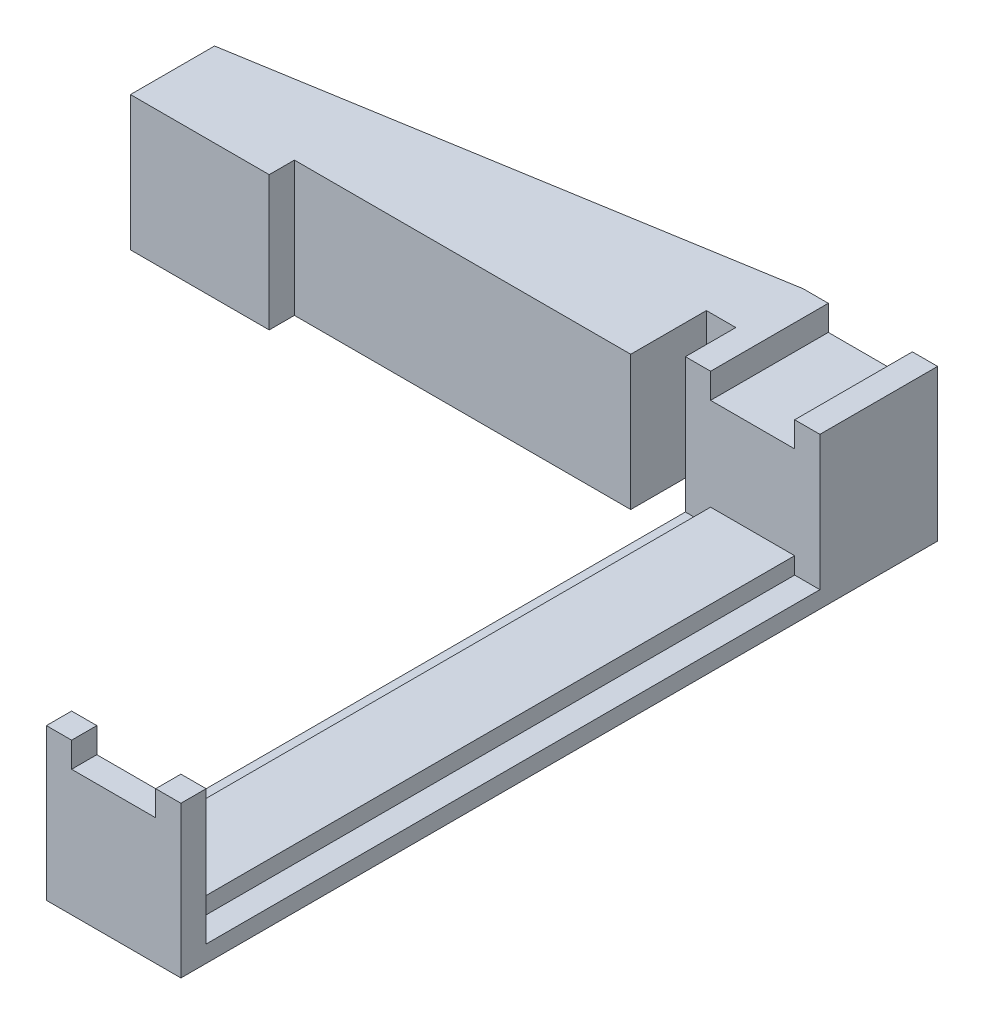
from build123d import *

# Parameters (mm, degrees)
BOSS_EXTRUDE1_DEPTH = 9
SKETCH2_W           = 8
SKETCH2_H           = 36.5
CUT_EXTRUDE2_DEPTH  = 7
SKETCH3_W           = 1.5
SKETCH3_H           = 36.5
CUT_EXTRUDE3_DEPTH  = 1
SKETCH4_W           = 1.75
SKETCH4_H           = 3
CUT_EXTRUDE4_DEPTH  = 53.440442409
SKETCH5_W           = 5
SKETCH5_H           = 45
CUT_EXTRUDE5_DEPTH  = 1.5
CUT_EXTRUDE6_DEPTH  = 1
SKETCH7_W           = 20
SKETCH7_H           = 1.5
CUT_EXTRUDE7_DEPTH  = 53.440442409
SKETCH8_W           = 1.75
SKETCH8_H           = 3
CUT_EXTRUDE8_DEPTH  = 53.440442409


with BuildPart() as part:
    # Sketch1 → Boss-Extrude1 (new body)
    with BuildSketch(Plane(origin=(0, 0, 0), x_dir=(1, 0, 0), z_dir=(0, 1, 0))):
        Polygon((0, 0), (30, 0), (30, -35), (38, -35), (38, 10), (30, 10), (0, 5), align=None)
    extrude(amount=BOSS_EXTRUDE1_DEPTH)

    # Sketch2 → Cut-Extrude2 (cut)
    with BuildSketch(Plane(origin=(0, 9, 0), x_dir=(1, 0, 0), z_dir=(0, 1, 0))):
        with Locations((34, -15.25)):
            Rectangle(SKETCH2_W, SKETCH2_H)
    extrude(amount=-CUT_EXTRUDE2_DEPTH, mode=Mode.SUBTRACT)

    # Sketch3 → Cut-Extrude3 (cut)
    with BuildSketch(Plane(origin=(0, 2, 0), x_dir=(1, 0, 0), z_dir=(0, 1, 0))):
        with Locations((37.25, -15.25)):
            Rectangle(SKETCH3_W, SKETCH3_H)
        with Locations((30.75, -15.25)):
            Rectangle(SKETCH3_W, SKETCH3_H)
    extrude(amount=-CUT_EXTRUDE3_DEPTH, mode=Mode.SUBTRACT)

    # Sketch4 → Cut-Extrude4 (cut, through all)
    with BuildSketch(Plane(origin=(0, 9, 0), x_dir=(1, 0, 0), z_dir=(0, 1, 0))):
        with Locations((29.125, 1.5)):
            Rectangle(SKETCH4_W, SKETCH4_H)
    extrude(amount=-CUT_EXTRUDE4_DEPTH, mode=Mode.SUBTRACT)

    # Sketch5 → Cut-Extrude5 (cut)
    with BuildSketch(Plane(origin=(0, 9, 0), x_dir=(1, 0, 0), z_dir=(0, 1, 0))):
        with Locations((34, -12.5)):
            Rectangle(SKETCH5_W, SKETCH5_H)
    extrude(amount=-CUT_EXTRUDE5_DEPTH, mode=Mode.SUBTRACT)

    # Sketch6 → Cut-Extrude6 (cut)
    with BuildSketch(Plane(origin=(0, 0, 0), x_dir=(-1, 0, 0), z_dir=(0, -1, 0))):
        Polygon((-28.25, 0), (-28.25, 9.708333333), (0, 5), (0, 0), align=None)
    extrude(amount=-CUT_EXTRUDE6_DEPTH, mode=Mode.SUBTRACT)

    # Sketch7 → Cut-Extrude7 (cut, through all)
    with BuildSketch(Plane(origin=(0, 9, 0), x_dir=(1, 0, 0), z_dir=(0, 1, 0))):
        with Locations((18.25, 0.75)):
            Rectangle(SKETCH7_W, SKETCH7_H)
    extrude(amount=-CUT_EXTRUDE7_DEPTH, mode=Mode.SUBTRACT)

    # Sketch8 → Cut-Extrude8 (cut, through all)
    with BuildSketch(Plane(origin=(0, 9, 0), x_dir=(1, 0, 0), z_dir=(0, 1, 0))):
        with Locations((29.125, 4.5)):
            Rectangle(SKETCH8_W, SKETCH8_H)
    extrude(amount=-CUT_EXTRUDE8_DEPTH, mode=Mode.SUBTRACT)


solid = part.part
